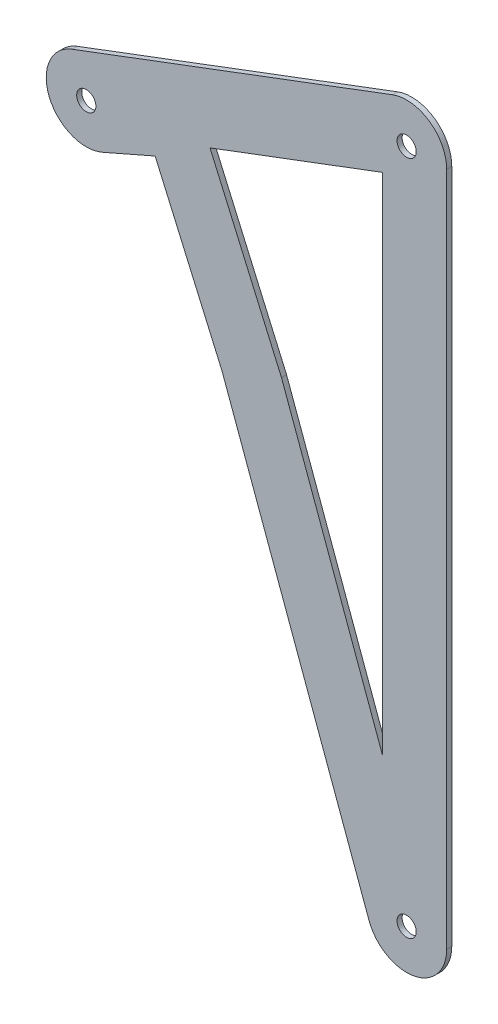
from build123d import *

# Parameters (mm, degrees)
SKETCH1_R           = 3
BOSS_EXTRUDE1_DEPTH = 1.5875


with BuildPart() as part:
    # Sketch1 → Boss-Extrude1 (new body)
    with BuildSketch(Plane.XY):
        with BuildLine():
            Line((12.5, 0), (12.5, 210.889668604))
            ThreePointArc((12.5, 210.889668604), (7.111624908, 221.169493076), (-4.407966588, 222.586669526))
            Line((-4.407966588, 222.586669526), (-104.407966588, 184.902081679))
            ThreePointArc((-104.407966588, 184.902081679), (-111.577605538, 168.492432881), (-94.985900649, 161.754805315))
            Line((-94.985900649, 161.754805315), (-78.497504012, 168.975108381))
            Line((-78.497504012, 168.975108381), (-57.638850711, 121.341962542))
            Line((-57.638850711, 121.341962542), (-11.740989728, -4.289424229))
            ThreePointArc((-11.740989728, -4.289424229), (2.17802989, -12.308784903), (12.5, 0))
        make_face()
        with Locations((-100, 173.205080757)):
            Circle(SKETCH1_R, mode=Mode.SUBTRACT)
        with Locations((0, 210.889668604)):
            Circle(SKETCH1_R, mode=Mode.SUBTRACT)
        Circle(SKETCH1_R, mode=Mode.SUBTRACT)
        Polygon((-39.067722995, 128.792048743), (-7.5, 42.385041268), (-7.5, 200.048449538), (-61.37972985, 179.744095411), align=None, mode=Mode.SUBTRACT)
    extrude(amount=BOSS_EXTRUDE1_DEPTH)


solid = part.part
